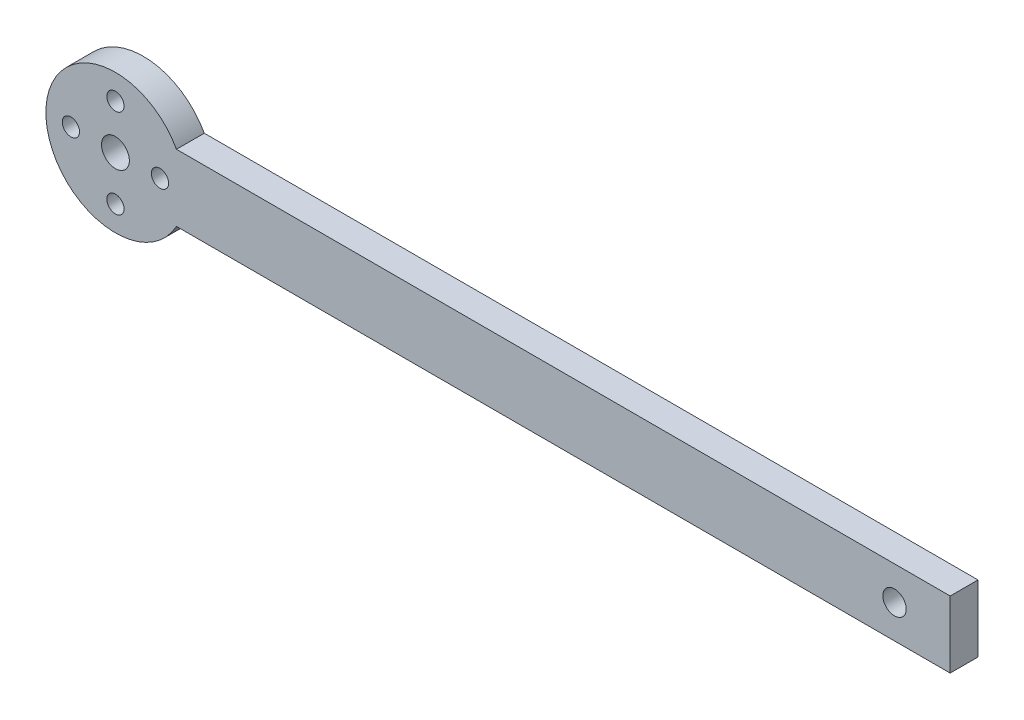
from build123d import *

# Parameters (mm, degrees)
BOSS_EXTRUDE1_DEPTH = 5
SKETCH2_R           = 2.1
SKETCH2_R_2         = 2.5
SKETCH2_R_3         = 1.55
CUT_EXTRUDE1_DEPTH  = 151.602954818


with BuildPart() as part:
    # Sketch1 → Boss-Extrude1 (new body)
    with BuildSketch(Plane.XY):
        with BuildLine():
            Line((10.9658561, 6), (150, 6))
            Line((150, 6), (150, -6))
            Line((150, -6), (10.9658561, -6))
            ThreePointArc((10.9658561, -6), (-12.5, 0), (10.9658561, 6))
        make_face()
    extrude(amount=BOSS_EXTRUDE1_DEPTH)

    # Sketch2 → Cut-Extrude1 (cut, through all)
    with BuildSketch(Plane.XY.offset(5)):
        with Locations((140, 0)):
            Circle(SKETCH2_R)
        Circle(SKETCH2_R_2)
        with Locations((0, 8)):
            Circle(SKETCH2_R_3)
        with Locations((8, 0)):
            Circle(SKETCH2_R_3)
        with Locations((0, -8)):
            Circle(SKETCH2_R_3)
        with Locations((-8, 0)):
            Circle(SKETCH2_R_3)
    extrude(amount=-CUT_EXTRUDE1_DEPTH, mode=Mode.SUBTRACT)


solid = part.part
